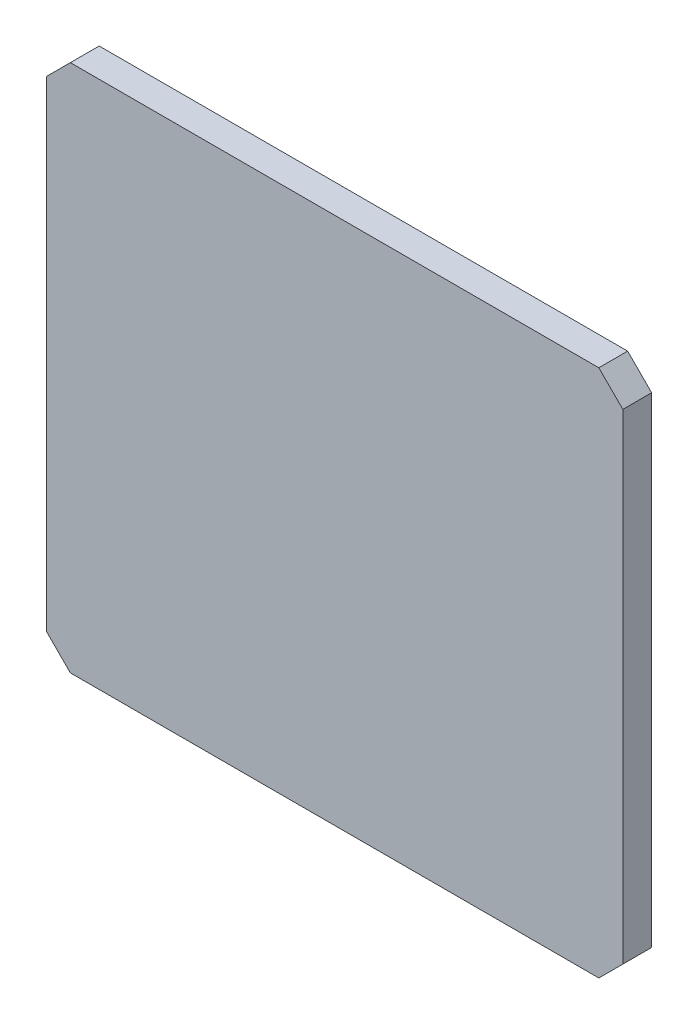
from build123d import *

# Parameters (mm, degrees)
CROQUIS1_W              = 36
CROQUIS1_H              = 33
SALIENTE_EXTRUIR1_DEPTH = 1.8
CHAFL_N1_SIZE           = 1.5


with BuildPart() as part:
    # Croquis1 → Saliente-Extruir1 (new body)
    with BuildSketch(Plane.XY):
        with Locations((6.13288066, -7.845821326)):
            Rectangle(CROQUIS1_W, CROQUIS1_H)
    extrude(amount=SALIENTE_EXTRUIR1_DEPTH)

    # Chaflán1
    chafl_n1_edges = [part.edges().sort_by_distance(p)[0] for p in [
        (-11.86711934, 8.654178674, 0.9),
        (24.13288066, 8.654178674, 0.9),
        (24.13288066, -24.345821326, 0.9),
        (-11.86711934, -24.345821326, 0.9),
    ]]
    chamfer(chafl_n1_edges, length=CHAFL_N1_SIZE)


solid = part.part
